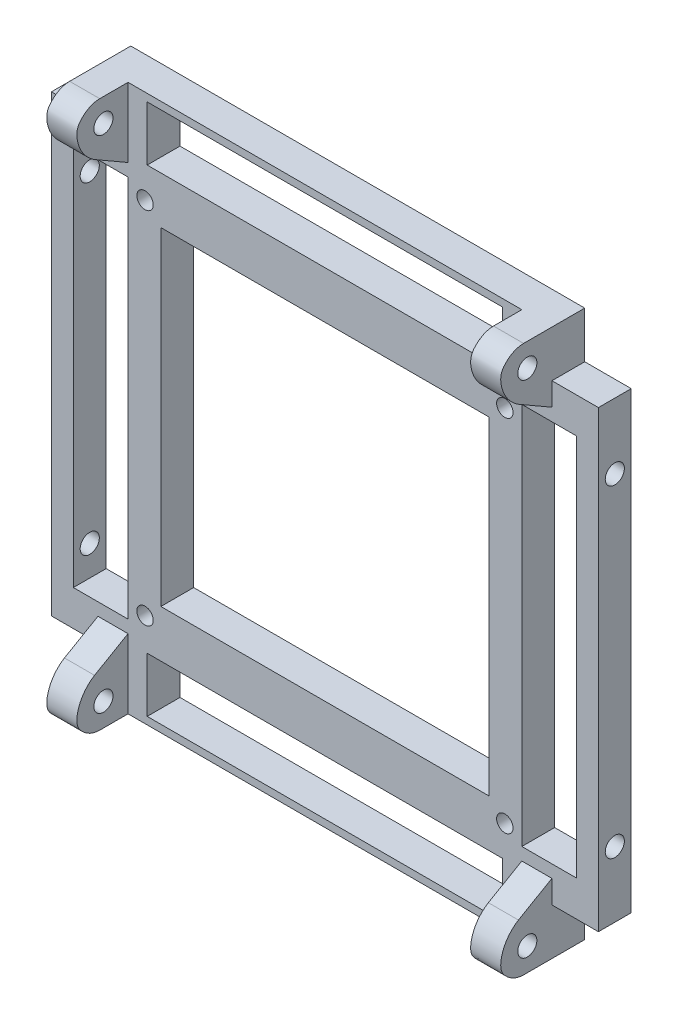
from build123d import *

# Parameters (mm, degrees)
BOSS_EXTRUDE1_DEPTH      = 6
BOSS_EXTRUDE2_DEPTH      = 5.5
MIRROR2_COPY_1_DEPTH     = 5.5
SKETCH5_R                = 1.75
CUT_EXTRUDE3_DEPTH       = 5.5
MIRROR12_COPY_1_SKETCH_R = 1.75
MIRROR12_COPY_1_DEPTH    = 5.5
SKETCH18_R               = 1.5
SKETCH18_W               = 60
SKETCH18_H               = 60
SKETCH18_W_2             = 10
SKETCH18_H_2             = 70
SKETCH18_W_3             = 65
SKETCH18_H_3             = 10
CUT_EXTRUDE11_DEPTH      = 72.327318291


with BuildPart() as part:
    # Sketch1 → Boss-Extrude1 (new body)
    with BuildSketch(Plane.XY):
        Polygon((-41.5, 50), (41.5, 50), (41.5, 41.5), (50, 41.5), (50, -41.5), (41.5, -41.5), (41.5, -50), (-41.5, -50), (-41.5, -41.5), (-50, -41.5), (-50, 41.5), (-41.5, 41.5), align=None)
    extrude(amount=BOSS_EXTRUDE1_DEPTH)

    # Sketch3 → Boss-Extrude2 (add)
    with BuildSketch(Plane(origin=(41.5, 0, 0), x_dir=(0, 0, -1), z_dir=(1, 0, 0))):
        with BuildLine():
            Line((-6, 37.3), (-6, 41.5))
            Line((-6, 41.5), (-6, 50))
            Line((-6, 50), (-11.178922224, 50))
            Line((-11.178922224, 50), (-11.466360598, 47.208988415))
            ThreePointArc((-11.466360598, 47.208988415), (-9.671939328, 47.291692422), (-8.75, 45.75))
            ThreePointArc((-8.75, 45.75), (-9.834235219, 44.131588045), (-11.743436864, 44.518592365))
            Line((-11.743436864, 44.518592365), (-12.122799605, 40.835))
            Line((-12.122799605, 40.835), (-6, 37.3))
        make_face()
        with BuildLine():
            add(Edge.make_bspline(
                [(-13.748830972, 42.243), (-13.287280997, 41.698559915), (-12.740439433, 41.224797274), (-12.122799605, 40.835)],
                knots=[0.829947962, 0.829947962, 0.829947962, 0.829947962, 1, 1, 1, 1], degree=3))
            Line((-12.122799605, 40.835), (-11.743436864, 44.518592365))
            ThreePointArc((-11.743436864, 44.518592365), (-11.889211305, 44.685766967), (-12.01266876, 44.870037942))
            Line((-12.01266876, 44.870037942), (-13.748830972, 42.243))
        make_face()
        with BuildLine():
            add(Edge.make_bspline(
                [(-15.180860914, 45.042121137), (-14.915949081, 43.985727264), (-14.423515632, 43.038851791), (-13.748830972, 42.243)],
                knots=[0.581369243, 0.581369243, 0.581369243, 0.581369243, 0.829947962, 0.829947962, 0.829947962, 0.829947962], degree=3))
            Line((-13.748830972, 42.243), (-12.01266876, 44.870037942))
            ThreePointArc((-12.01266876, 44.870037942), (-12.127586755, 45.106990392), (-12.205646827, 45.358504276))
            Line((-12.205646827, 45.358504276), (-15.180860914, 45.042121137))
        make_face()
        with BuildLine():
            add(Edge.make_bspline(
                [(-15.120890934, 47.5875), (-15.460705735, 46.824831349), (-15.395381329, 45.897568208), (-15.180860914, 45.042121137)],
                knots=[0.380075065, 0.380075065, 0.380075065, 0.380075065, 0.581369243, 0.581369243, 0.581369243, 0.581369243], degree=3))
            Line((-15.180860914, 45.042121137), (-12.205646827, 45.358504276))
            ThreePointArc((-12.205646827, 45.358504276), (-12.241108324, 45.573813155), (-12.24949925, 45.791861369))
            Line((-12.24949925, 45.791861369), (-15.120890934, 47.5875))
        make_face()
        with BuildLine():
            ThreePointArc((-12.24949925, 45.791861369), (-12.236392573, 45.967809165), (-12.205635976, 46.141542994))
            Line((-12.205635976, 46.141542994), (-14.210030358, 48.7575))
            add(Edge.make_bspline(
                [(-14.210030358, 48.7575), (-14.58769334, 48.419983952), (-14.922993936, 48.031653216), (-15.120890934, 47.5875)],
                knots=[0.262847935, 0.262847935, 0.262847935, 0.262847935, 0.380075065, 0.380075065, 0.380075065, 0.380075065], degree=3))
            Line((-15.120890934, 47.5875), (-12.24949925, 45.791861369))
        make_face()
        with BuildLine():
            Line((-11.807057512, 46.913658309), (-12.117521955, 49.8875))
            add(Edge.make_bspline(
                [(-12.117521955, 49.8875), (-12.889625391, 49.709440811), (-13.60431339, 49.298827076), (-14.210030358, 48.7575)],
                knots=[0.074832522, 0.074832522, 0.074832522, 0.074832522, 0.262847935, 0.262847935, 0.262847935, 0.262847935], degree=3))
            Line((-14.210030358, 48.7575), (-12.205635976, 46.141542994))
            ThreePointArc((-12.205635976, 46.141542994), (-12.055030877, 46.552732192), (-11.807057512, 46.913658309))
        make_face()
        with BuildLine():
            Line((-11.650860914, 47.068339545), (-11.650860914, 49.9675))
            add(Edge.make_bspline(
                [(-11.650860914, 49.9675), (-11.807805321, 49.949182677), (-11.963801555, 49.92295034), (-12.117521955, 49.8875)],
                knots=[0.037399967, 0.037399967, 0.037399967, 0.037399967, 0.074832522, 0.074832522, 0.074832522, 0.074832522], degree=3))
            Line((-12.117521955, 49.8875), (-11.807057512, 46.913658309))
            ThreePointArc((-11.807057512, 46.913658309), (-11.731390401, 46.993453932), (-11.650860914, 47.068339545))
        make_face()
        with BuildLine():
            Line((-11.466360598, 47.208988415), (-11.178922224, 50))
            add(Edge.make_bspline(
                [(-11.178922224, 50), (-11.336298844, 49.996201513), (-11.49405314, 49.985801376), (-11.650860914, 49.9675)],
                knots=[0, 0, 0, 0, 0.037399967, 0.037399967, 0.037399967, 0.037399967], degree=3))
            Line((-11.650860914, 49.9675), (-11.650860914, 47.068339545))
            ThreePointArc((-11.650860914, 47.068339545), (-11.560944042, 47.141724736), (-11.466360598, 47.208988415))
        make_face()
    boss_extrude2 = extrude(amount=-BOSS_EXTRUDE2_DEPTH)

    # Mirror1: Boss-Extrude2 across plane
    add(boss_extrude2.mirror(Plane(origin=(0, 0, 0), x_dir=(0, 0, 1), z_dir=(1, 0, 0))))

    # Mirror2: Boss-Extrude2 across plane
    add(boss_extrude2.mirror(Plane.ZX))

    # Mirror2 copy 1 sketch → Mirror2 copy 1 (add)
    with BuildSketch(Plane(origin=(-41.5, 0, 0), x_dir=(0, 0, -1), z_dir=(-1, 0, 0))):
        with BuildLine():
            Line((-6, 37.3), (-6, 41.5))
            Line((-6, 41.5), (-6, 50))
            Line((-6, 50), (-11.178922224, 50))
            Line((-11.178922224, 50), (-11.466360598, 47.208988415))
            ThreePointArc((-11.466360598, 47.208988415), (-9.671939328, 47.291692422), (-8.75, 45.75))
            ThreePointArc((-8.75, 45.75), (-9.834235219, 44.131588045), (-11.743436864, 44.518592365))
            Line((-11.743436864, 44.518592365), (-12.122799605, 40.835))
            Line((-12.122799605, 40.835), (-6, 37.3))
        make_face()
        with BuildLine():
            add(Edge.make_bspline(
                [(-13.748830972, 42.243), (-13.287280997, 41.698559915), (-12.740439433, 41.224797274), (-12.122799605, 40.835)],
                knots=[0.829947962, 0.829947962, 0.829947962, 0.829947962, 1, 1, 1, 1], degree=3))
            Line((-12.122799605, 40.835), (-11.743436864, 44.518592365))
            ThreePointArc((-11.743436864, 44.518592365), (-11.889211305, 44.685766967), (-12.01266876, 44.870037942))
            Line((-12.01266876, 44.870037942), (-13.748830972, 42.243))
        make_face()
        with BuildLine():
            add(Edge.make_bspline(
                [(-15.180860914, 45.042121137), (-14.915949081, 43.985727264), (-14.423515632, 43.038851791), (-13.748830972, 42.243)],
                knots=[0.581369243, 0.581369243, 0.581369243, 0.581369243, 0.829947962, 0.829947962, 0.829947962, 0.829947962], degree=3))
            Line((-13.748830972, 42.243), (-12.01266876, 44.870037942))
            ThreePointArc((-12.01266876, 44.870037942), (-12.127586755, 45.106990392), (-12.205646827, 45.358504276))
            Line((-12.205646827, 45.358504276), (-15.180860914, 45.042121137))
        make_face()
        with BuildLine():
            add(Edge.make_bspline(
                [(-15.120890934, 47.5875), (-15.460705735, 46.824831349), (-15.395381329, 45.897568208), (-15.180860914, 45.042121137)],
                knots=[0.380075065, 0.380075065, 0.380075065, 0.380075065, 0.581369243, 0.581369243, 0.581369243, 0.581369243], degree=3))
            Line((-15.180860914, 45.042121137), (-12.205646827, 45.358504276))
            ThreePointArc((-12.205646827, 45.358504276), (-12.241108324, 45.573813155), (-12.24949925, 45.791861369))
            Line((-12.24949925, 45.791861369), (-15.120890934, 47.5875))
        make_face()
        with BuildLine():
            ThreePointArc((-12.24949925, 45.791861369), (-12.236392573, 45.967809165), (-12.205635976, 46.141542994))
            Line((-12.205635976, 46.141542994), (-14.210030358, 48.7575))
            add(Edge.make_bspline(
                [(-14.210030358, 48.7575), (-14.58769334, 48.419983952), (-14.922993936, 48.031653216), (-15.120890934, 47.5875)],
                knots=[0.262847935, 0.262847935, 0.262847935, 0.262847935, 0.380075065, 0.380075065, 0.380075065, 0.380075065], degree=3))
            Line((-15.120890934, 47.5875), (-12.24949925, 45.791861369))
        make_face()
        with BuildLine():
            Line((-11.807057512, 46.913658309), (-12.117521955, 49.8875))
            add(Edge.make_bspline(
                [(-12.117521955, 49.8875), (-12.889625391, 49.709440811), (-13.60431339, 49.298827076), (-14.210030358, 48.7575)],
                knots=[0.074832522, 0.074832522, 0.074832522, 0.074832522, 0.262847935, 0.262847935, 0.262847935, 0.262847935], degree=3))
            Line((-14.210030358, 48.7575), (-12.205635976, 46.141542994))
            ThreePointArc((-12.205635976, 46.141542994), (-12.055030877, 46.552732192), (-11.807057512, 46.913658309))
        make_face()
        with BuildLine():
            Line((-11.650860914, 47.068339545), (-11.650860914, 49.9675))
            add(Edge.make_bspline(
                [(-11.650860914, 49.9675), (-11.807805321, 49.949182677), (-11.963801555, 49.92295034), (-12.117521955, 49.8875)],
                knots=[0.037399967, 0.037399967, 0.037399967, 0.037399967, 0.074832522, 0.074832522, 0.074832522, 0.074832522], degree=3))
            Line((-12.117521955, 49.8875), (-11.807057512, 46.913658309))
            ThreePointArc((-11.807057512, 46.913658309), (-11.731390401, 46.993453932), (-11.650860914, 47.068339545))
        make_face()
        with BuildLine():
            Line((-11.466360598, 47.208988415), (-11.178922224, 50))
            add(Edge.make_bspline(
                [(-11.178922224, 50), (-11.336298844, 49.996201513), (-11.49405314, 49.985801376), (-11.650860914, 49.9675)],
                knots=[0, 0, 0, 0, 0.037399967, 0.037399967, 0.037399967, 0.037399967], degree=3))
            Line((-11.650860914, 49.9675), (-11.650860914, 47.068339545))
            ThreePointArc((-11.650860914, 47.068339545), (-11.560944042, 47.141724736), (-11.466360598, 47.208988415))
        make_face()
    extrude(amount=-MIRROR2_COPY_1_DEPTH)

    # Sketch5 → Cut-Extrude3 (cut)
    with BuildSketch(Plane.ZY.offset(50)):
        with Locations(Location((3, 29.5, 0), (0, 0, 270))):
            Circle(SKETCH5_R)
    cut_extrude3 = extrude(amount=-CUT_EXTRUDE3_DEPTH, mode=Mode.SUBTRACT)

    # Mirror11: Cut-Extrude3 across plane
    add(cut_extrude3.mirror(Plane(origin=(0, 0, 0), x_dir=(0, 0, 1), z_dir=(1, 0, 0))), mode=Mode.SUBTRACT)

    # Mirror12: Cut-Extrude3 across plane
    add(cut_extrude3.mirror(Plane.ZX), mode=Mode.SUBTRACT)

    # Mirror12 copy 1 sketch → Mirror12 copy 1 (cut)
    with BuildSketch(Plane(origin=(50, 0, 0), x_dir=(0, 0, 1), z_dir=(1, 0, 0))):
        with Locations(Location((3, 29.5, 0), (0, 0, 270))):
            Circle(MIRROR12_COPY_1_SKETCH_R)
    extrude(amount=-MIRROR12_COPY_1_DEPTH, mode=Mode.SUBTRACT)

    # Sketch18 → Cut-Extrude11 (cut, through all)
    with BuildSketch(Plane.XY.offset(6)):
        with Locations((-32.89, 32.89)):
            Circle(SKETCH18_R)
        with Locations(Location((32.89, 32.89, 0), (0, 0, 180))):
            Circle(SKETCH18_R)
        with Locations((32.89, -32.89)):
            Circle(SKETCH18_R)
        with Locations(Location((-32.89, -32.89, 0), (0, 0, 180))):
            Circle(SKETCH18_R)
        Rectangle(SKETCH18_W, SKETCH18_H)
        with Locations((-41, 0)):
            Rectangle(SKETCH18_W_2, SKETCH18_H_2)
        with Locations((41, 0)):
            Rectangle(SKETCH18_W_2, SKETCH18_H_2)
        with Locations((0, -43.65)):
            Rectangle(SKETCH18_W_3, SKETCH18_H_3)
        with Locations((0, 43.65)):
            Rectangle(SKETCH18_W_3, SKETCH18_H_3)
    extrude(amount=-CUT_EXTRUDE11_DEPTH, mode=Mode.SUBTRACT)


solid = part.part
